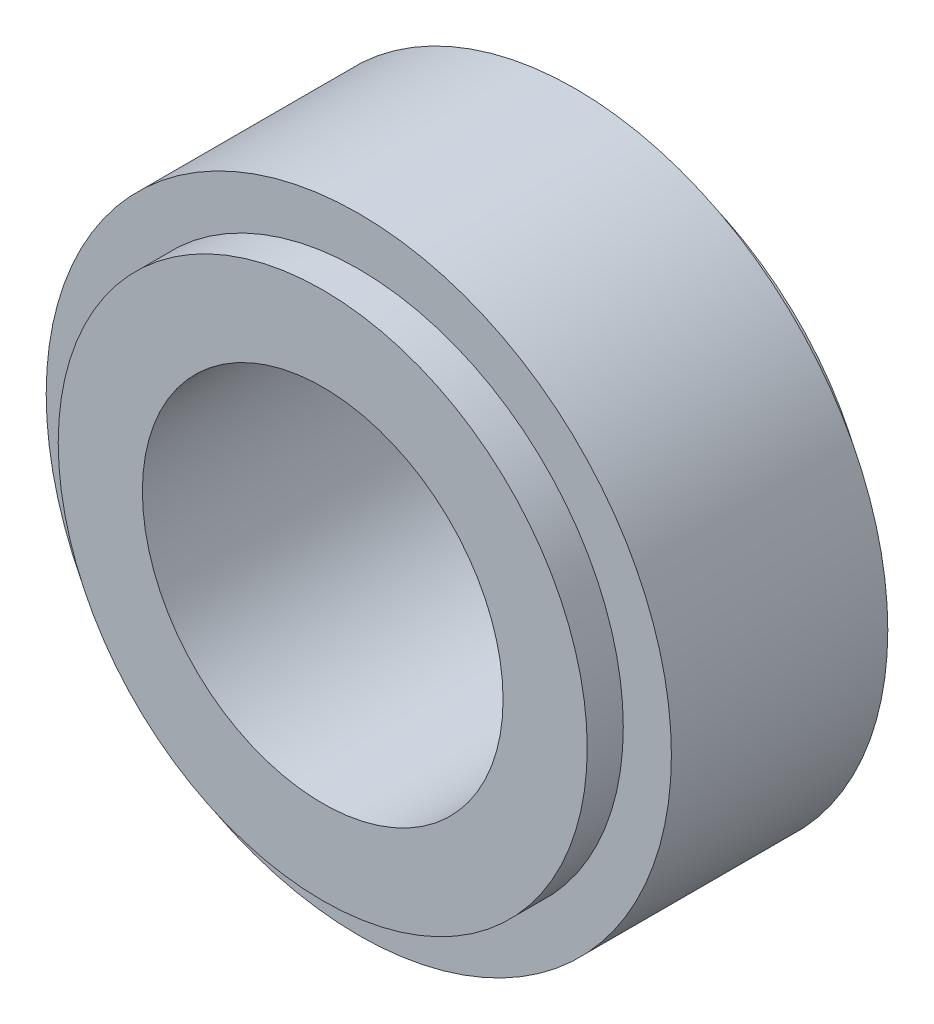
from build123d import *

# Parameters (mm, degrees)
SKETCH1_R           = 11
SKETCH1_R_2         = 7.5
BOSS_EXTRUDE1_DEPTH = 6
SKETCH2_R           = 13
SKETCH2_R_2         = 7.5
BOSS_EXTRUDE2_DEPTH = 4.5


with BuildPart() as part:
    # Sketch1 → Boss-Extrude1 (new, symmetric)
    with BuildSketch(Plane.XY):
        Circle(SKETCH1_R)
        Circle(SKETCH1_R_2, mode=Mode.SUBTRACT)
    extrude(amount=BOSS_EXTRUDE1_DEPTH, both=True)

    # Sketch2 → Boss-Extrude2 (add, symmetric)
    with BuildSketch(Plane.XY):
        Circle(SKETCH2_R)
        Circle(SKETCH2_R_2, mode=Mode.SUBTRACT)
    extrude(amount=BOSS_EXTRUDE2_DEPTH, both=True)


solid = part.part
